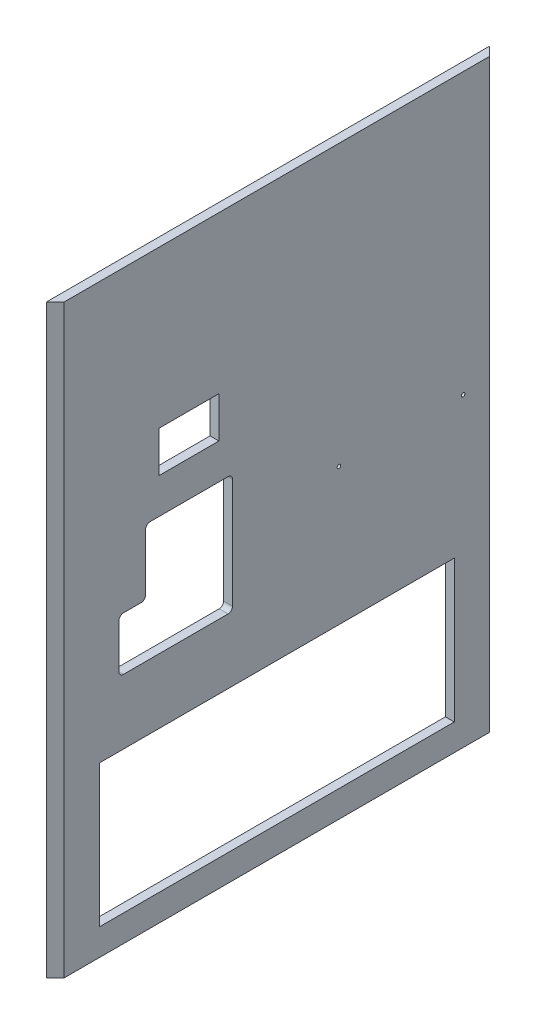
from build123d import *

# Parameters (mm, degrees)
CROQUIS1_W              = 5
CROQUIS1_H              = 250
SALIENTE_EXTRUIR1_DEPTH = 330
CORTAR_EXTRUIR1_REACH   = 416.035
CORTAR_EXTRUIR2_REACH   = 416.035
CROQUIS3_W              = 200
CROQUIS3_H              = 80
CORTAR_EXTRUIR3_DEPTH   = 415.035022673
REDONDEO1_R             = 2.5
CROQUIS5_W              = 33.7
CROQUIS5_H              = 23.1
CORTAR_EXTRUIR4_DEPTH   = 415.035022673
CORTAR_EXTRUIR5_REACH   = 416.035
CROQUIS6_R              = 1


with BuildPart() as part:
    # Croquis1 → Saliente-Extruir1 (new body)
    with BuildSketch(Plane(origin=(0, 0, 0), x_dir=(1, 0, 0), z_dir=(0, 1, 0))):
        with Locations((-2.5, 125)):
            Rectangle(CROQUIS1_W, CROQUIS1_H)
    extrude(amount=SALIENTE_EXTRUIR1_DEPTH)

    # Croquis2 → Cortar-Extruir1 (cut, up to next)
    with BuildSketch(Plane(origin=(0, 330, 0), x_dir=(1, 0, 0), z_dir=(0, 1, 0)), mode=Mode.PRIVATE) as cortar_extruir1_sk1:
        Polygon((0, 250), (0, 245), (-5, 250), align=None)
    cortar_extruir1_tool1 = extrude(cortar_extruir1_sk1.sketch, amount=-CORTAR_EXTRUIR1_REACH, mode=Mode.PRIVATE) & part.part
    # Croquis2 → Cortar-Extruir1 (cut, up to next)
    with BuildSketch(Plane(origin=(0, 330, 0), x_dir=(1, 0, 0), z_dir=(0, 1, 0)), mode=Mode.PRIVATE) as cortar_extruir1_sk2:
        Polygon((-5, 0), (0, 5), (0, 0), align=None)
    cortar_extruir1_tool2 = extrude(cortar_extruir1_sk2.sketch, amount=-CORTAR_EXTRUIR1_REACH, mode=Mode.PRIVATE) & part.part
    add(cortar_extruir1_tool1.solids().sort_by_distance((-1.666667, 330, -248.333333))[0], mode=Mode.SUBTRACT)
    add(cortar_extruir1_tool2.solids().sort_by_distance((-1.666667, 330, -1.666667))[0], mode=Mode.SUBTRACT)

    # Croquis3 → Cortar-Extruir2 (cut, up to next)
    with BuildSketch(Plane.ZY.offset(5), mode=Mode.PRIVATE) as cortar_extruir2_sk1:
        with Locations((-125, 55)):
            Rectangle(CROQUIS3_W, CROQUIS3_H)
    cortar_extruir2_tool1 = extrude(cortar_extruir2_sk1.sketch, amount=-CORTAR_EXTRUIR2_REACH, mode=Mode.PRIVATE) & part.part
    add(cortar_extruir2_tool1.solids().sort_by_distance((-5, 55, -125))[0], mode=Mode.SUBTRACT)

    # Croquis4 → Cortar-Extruir3 (cut, through all)
    with BuildSketch(Plane.ZY.offset(5)):
        Polygon((-100, 198.5), (-100, 131.5), (-51, 131.5), (-36, 131.5), (-36, 161.5), (-51, 161.5), (-51, 198.5), align=None)
    extrude(amount=-CORTAR_EXTRUIR3_DEPTH, mode=Mode.SUBTRACT)

    # Redondeo1
    redondeo1_edges = [part.edges().sort_by_distance(p)[0] for p in [
        (-2.5, 131.5, -100),
        (-2.5, 198.5, -100),
        (-2.5, 198.5, -51),
        (-2.5, 161.5, -51),
        (-2.5, 161.5, -36),
        (-2.5, 131.5, -36),
    ]]
    fillet(redondeo1_edges, radius=REDONDEO1_R)

    # Croquis5 → Cortar-Extruir4 (cut, through all)
    with BuildSketch(Plane.ZY.offset(5)):
        with Locations((-75.5, 230.05)):
            Rectangle(CROQUIS5_W, CROQUIS5_H)
    extrude(amount=-CORTAR_EXTRUIR4_DEPTH, mode=Mode.SUBTRACT)

    # Croquis6 → Cortar-Extruir5 (cut, up to next)
    with BuildSketch(Plane.ZY.offset(5), mode=Mode.PRIVATE) as cortar_extruir5_sk1:
        with Locations((-230, 172.2)):
            Circle(CROQUIS6_R)
    cortar_extruir5_tool1 = extrude(cortar_extruir5_sk1.sketch, amount=-CORTAR_EXTRUIR5_REACH, mode=Mode.PRIVATE) & part.part
    # Croquis6 → Cortar-Extruir5 (cut, up to next)
    with BuildSketch(Plane.ZY.offset(5), mode=Mode.PRIVATE) as cortar_extruir5_sk2:
        with Locations((-160, 172.2)):
            Circle(CROQUIS6_R)
    cortar_extruir5_tool2 = extrude(cortar_extruir5_sk2.sketch, amount=-CORTAR_EXTRUIR5_REACH, mode=Mode.PRIVATE) & part.part
    add(cortar_extruir5_tool1.solids().sort_by_distance((-5, 172.2, -230))[0], mode=Mode.SUBTRACT)
    add(cortar_extruir5_tool2.solids().sort_by_distance((-5, 172.2, -160))[0], mode=Mode.SUBTRACT)


solid = part.part
